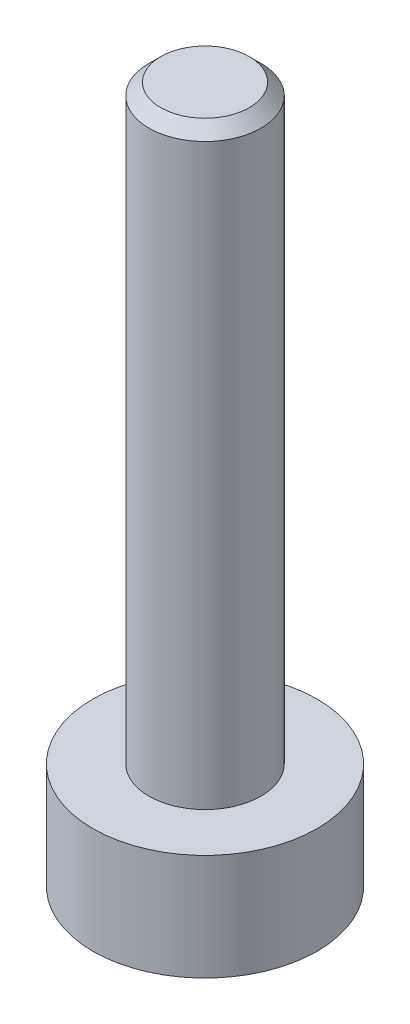
from build123d import *

# Parameters (mm, degrees)
CUT_EXTRUDE1_DEPTH = 1


with BuildPart() as part:
    # Sketch1 → Base-Revolve (revolve)
    with BuildSketch(Plane.XY, mode=Mode.PRIVATE) as base_revolve_sk:
        Polygon((0.95, 0), (1.9, 0), (1.9, -1.8), (1.553589838, -2), (0, -2), (0, 10), (0.75, 10), (0.95, 9.8), align=None)
    revolve(base_revolve_sk.sketch.rotate(Axis((0, -2, 0), (0, -1, 0)), 180), axis=Axis((0, -2, 0), (0, -1, 0)))

    # Sketch2 → Cut-Extrude1 (cut)
    with BuildSketch(Plane.XZ.offset(2)):
        Polygon((-0.433012702, 0.75), (0.433012702, 0.75), (0.866025404, 0), (0.433012702, -0.75), (-0.433012702, -0.75), (-0.866025404, 0), align=None)
    extrude(amount=-CUT_EXTRUDE1_DEPTH, mode=Mode.SUBTRACT)


solid = part.part
